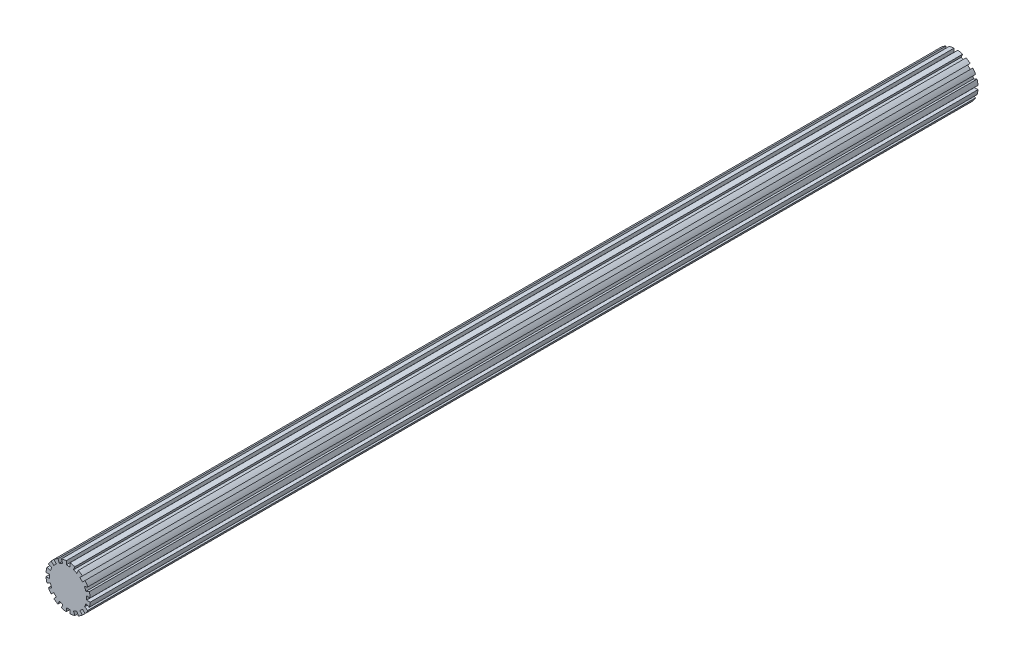
from build123d import *

# Parameters (mm, degrees)
SKETCH1_R           = 3
BOSS_EXTRUDE1_DEPTH = 120
CUT_EXTRUDE2_DEPTH  = 121.074976577


with BuildPart() as part:
    # Sketch1 → Boss-Extrude1 (new body)
    with BuildSketch(Plane.XY):
        Circle(SKETCH1_R)
    extrude(amount=BOSS_EXTRUDE1_DEPTH)

    # Sketch2 → Cut-Extrude2 (cut, through all)
    with BuildSketch(Plane.XY.offset(120)):
        with BuildLine():
            ThreePointArc((2.857977755, 0.912120142), (2.771638598, 1.148050297), (2.665861788, 1.375929113))
            Line((2.665861788, 1.375929113), (2.21589064, 1.189544961))
            Line((2.21589064, 1.189544961), (2.408006606, 0.725735989))
            Line((2.408006606, 0.725735989), (2.857977755, 0.912120142))
        make_face()
        with BuildLine():
            ThreePointArc((2.291373885, 1.936389867), (2.121320344, 2.121320344), (1.936389867, 2.291373885))
            Line((1.936389867, 2.291373885), (1.59199686, 1.946980878))
            Line((1.59199686, 1.946980878), (1.946980878, 1.59199686))
            Line((1.946980878, 1.59199686), (2.291373885, 1.936389867))
        make_face()
        with BuildLine():
            ThreePointArc((0.251011607, 2.989480419), (0.125615971, 2.997368951), (0, 3))
            Line((0, 3), (0, 2.502435157))
            Line((0, 2.502435157), (0.251011607, 2.502435157))
            Line((0.251011607, 2.502435157), (0.251011607, 2.989480419))
        make_face()
        with BuildLine():
            Line((0, 2.502435157), (0, 3))
            ThreePointArc((0, 3), (-0.125615971, 2.997368951), (-0.251011607, 2.989480419))
            Line((-0.251011607, 2.989480419), (-0.251011607, 2.502435157))
            Line((-0.251011607, 2.502435157), (0, 2.502435157))
        make_face()
        with BuildLine():
            Line((-0.725735989, 2.408006606), (-0.912120142, 2.857977755))
            ThreePointArc((-0.912120142, 2.857977755), (-1.148050297, 2.771638598), (-1.375929113, 2.665861788))
            Line((-1.375929113, 2.665861788), (-1.189544961, 2.21589064))
            Line((-1.189544961, 2.21589064), (-0.725735989, 2.408006606))
        make_face()
        with BuildLine():
            Line((-1.59199686, 1.946980878), (-1.936389867, 2.291373885))
            ThreePointArc((-1.936389867, 2.291373885), (-2.121320344, 2.121320344), (-2.291373885, 1.936389867))
            Line((-2.291373885, 1.936389867), (-1.946980878, 1.59199686))
            Line((-1.946980878, 1.59199686), (-1.59199686, 1.946980878))
        make_face()
        with BuildLine():
            Line((-2.21589064, 1.189544961), (-2.665861788, 1.375929113))
            ThreePointArc((-2.665861788, 1.375929113), (-2.771638598, 1.148050297), (-2.857977755, 0.912120142))
            Line((-2.857977755, 0.912120142), (-2.408006606, 0.725735989))
            Line((-2.408006606, 0.725735989), (-2.21589064, 1.189544961))
        make_face()
        with BuildLine():
            Line((-2.502435157, 0.251011607), (-2.989480419, 0.251011607))
            ThreePointArc((-2.989480419, 0.251011607), (-3, 0), (-2.989480419, -0.251011607))
            Line((-2.989480419, -0.251011607), (-2.502435157, -0.251011607))
            Line((-2.502435157, -0.251011607), (-2.502435157, 0.251011607))
        make_face()
        with BuildLine():
            Line((-2.408006606, -0.725735989), (-2.857977755, -0.912120142))
            ThreePointArc((-2.857977755, -0.912120142), (-2.771638598, -1.148050297), (-2.665861788, -1.375929113))
            Line((-2.665861788, -1.375929113), (-2.21589064, -1.189544961))
            Line((-2.21589064, -1.189544961), (-2.408006606, -0.725735989))
        make_face()
        with BuildLine():
            Line((-1.946980878, -1.59199686), (-2.291373885, -1.936389867))
            ThreePointArc((-2.291373885, -1.936389867), (-2.121320344, -2.121320344), (-1.936389867, -2.291373885))
            Line((-1.936389867, -2.291373885), (-1.59199686, -1.946980878))
            Line((-1.59199686, -1.946980878), (-1.946980878, -1.59199686))
        make_face()
        with BuildLine():
            Line((-1.189544961, -2.21589064), (-1.375929113, -2.665861788))
            ThreePointArc((-1.375929113, -2.665861788), (-1.148050297, -2.771638598), (-0.912120142, -2.857977755))
            Line((-0.912120142, -2.857977755), (-0.725735989, -2.408006606))
            Line((-0.725735989, -2.408006606), (-1.189544961, -2.21589064))
        make_face()
        with BuildLine():
            Line((-0.251011607, -2.502435157), (-0.251011607, -2.989480419))
            ThreePointArc((-0.251011607, -2.989480419), (0, -3), (0.251011607, -2.989480419))
            Line((0.251011607, -2.989480419), (0.251011607, -2.502435157))
            Line((0.251011607, -2.502435157), (-0.251011607, -2.502435157))
        make_face()
        with BuildLine():
            ThreePointArc((0.912120142, -2.857977755), (1.148050297, -2.771638598), (1.375929113, -2.665861788))
            Line((1.375929113, -2.665861788), (1.189544961, -2.21589064))
            Line((1.189544961, -2.21589064), (0.725735989, -2.408006606))
            Line((0.725735989, -2.408006606), (0.912120142, -2.857977755))
        make_face()
        with BuildLine():
            ThreePointArc((1.936389867, -2.291373885), (2.121320344, -2.121320344), (2.291373885, -1.936389867))
            Line((2.291373885, -1.936389867), (1.946980878, -1.59199686))
            Line((1.946980878, -1.59199686), (1.59199686, -1.946980878))
            Line((1.59199686, -1.946980878), (1.936389867, -2.291373885))
        make_face()
        with BuildLine():
            ThreePointArc((2.665861788, -1.375929113), (2.771638598, -1.148050297), (2.857977755, -0.912120142))
            Line((2.857977755, -0.912120142), (2.408006606, -0.725735989))
            Line((2.408006606, -0.725735989), (2.21589064, -1.189544961))
            Line((2.21589064, -1.189544961), (2.665861788, -1.375929113))
        make_face()
        with BuildLine():
            ThreePointArc((3, 0), (2.997368951, 0.125615971), (2.989480419, 0.251011607))
            Line((2.989480419, 0.251011607), (2.502435157, 0.251011607))
            Line((2.502435157, 0.251011607), (2.502435157, -0.251011607))
            Line((2.502435157, -0.251011607), (2.989480419, -0.251011607))
            ThreePointArc((2.989480419, -0.251011607), (2.997368951, -0.125615971), (3, 0))
        make_face()
        with BuildLine():
            ThreePointArc((1.375929113, 2.665861788), (1.148050297, 2.771638598), (0.912120142, 2.857977755))
            Line((0.912120142, 2.857977755), (0.725735989, 2.408006606))
            Line((0.725735989, 2.408006606), (1.189544961, 2.21589064))
            Line((1.189544961, 2.21589064), (1.375929113, 2.665861788))
        make_face()
    extrude(amount=-CUT_EXTRUDE2_DEPTH, mode=Mode.SUBTRACT)


solid = part.part
